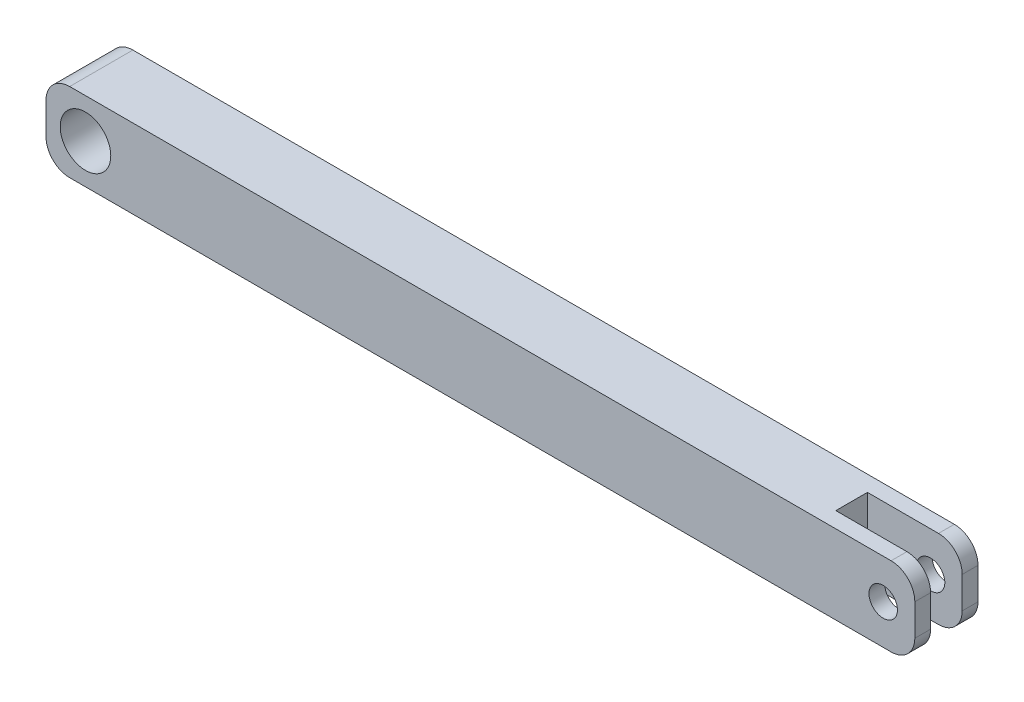
from build123d import *

# Parameters (mm, degrees)
SKETCH_5_W          = 55
SKETCH_5_H          = 3
EXTRUDE_1_DEPTH     = 5
CUT_EXTRUDE_1_REACH = 57.308
SKETCH_6_R          = 1.6
CUT_EXTRUDE_2_REACH = 57.308
SKETCH_7_R          = 0.9
FILLET_1_R          = 1.5
SKETCH_8_W          = 6
SKETCH_8_H          = 1.6
CUT_EXTRUDE_3_DEPTH = 10
SKETCH_10_R         = 1.6
SKETCH_10_R_2       = 0.9
EXTRUDE_2_DEPTH     = 0.5
EXTRUDE_START       = 0.5
SKETCH_11_R         = 0.9
SKETCH_11_R_2       = 1.6
EXTRUDE_3_DEPTH     = 0.5
SKETCH_12_W         = 6.141615249
SKETCH_12_H         = 2
CUT_EXTRUDE_4_DEPTH = 10


with BuildPart() as part:
    # 草图5 → 凸台-拉伸1 (new body)
    with BuildSketch(Plane(origin=(0, 0, 0), x_dir=(1, 0, 0), z_dir=(0, 1, 0))):
        with Locations((27.5, -1.5)):
            Rectangle(SKETCH_5_W, SKETCH_5_H)
    extrude(amount=EXTRUDE_1_DEPTH)

    # 草图6 → 切除-拉伸1 (cut, up to next)
    with BuildSketch(Plane.XY.offset(3), mode=Mode.PRIVATE) as cut_extrude_1_sk1:
        with Locations((2.5, 2.5)):
            Circle(SKETCH_6_R)
    cut_extrude_1_tool1 = extrude(cut_extrude_1_sk1.sketch, amount=-CUT_EXTRUDE_1_REACH, mode=Mode.PRIVATE) & part.part
    add(cut_extrude_1_tool1.solids().sort_by_distance((2.5, 2.5, 3))[0], mode=Mode.SUBTRACT)

    # 草图7 → 切除-拉伸2 (cut, up to next)
    with BuildSketch(Plane.XY, mode=Mode.PRIVATE) as cut_extrude_2_sk1:
        with Locations(Location((53, 2.5, 0), (0, 0, 180))):
            Circle(SKETCH_7_R)
    cut_extrude_2_tool1 = extrude(cut_extrude_2_sk1.sketch, amount=CUT_EXTRUDE_2_REACH, mode=Mode.PRIVATE) & part.part
    add(cut_extrude_2_tool1.solids().sort_by_distance((53, 2.5, 0))[0], mode=Mode.SUBTRACT)

    # 圆角1
    fillet_1_edges = [part.edges().sort_by_distance(p)[0] for p in [
        (55, 5, 1.5),
        (55, 0, 1.5),
        (0, 0, 1.5),
        (0, 5, 1.5),
    ]]
    fillet(fillet_1_edges, radius=FILLET_1_R)

    # 草图8 → 切除-拉伸3 (cut)
    with BuildSketch(Plane(origin=(0, 5, 0), x_dir=(1, 0, 0), z_dir=(0, 1, 0))):
        with Locations((52, -1.5)):
            Rectangle(SKETCH_8_W, SKETCH_8_H)
    extrude(amount=-CUT_EXTRUDE_3_DEPTH, mode=Mode.SUBTRACT)

    # 草图10 → 凸台-拉伸2 (add)
    with BuildSketch(Plane.XY.offset(3)):
        with BuildLine():
            Line((0, 3.5), (0, 1.5))
            ThreePointArc((0, 1.5), (0.439339828, 0.439339828), (1.5, 0))
            Line((1.5, 0), (53.5, 0))
            ThreePointArc((53.5, 0), (54.560660172, 0.439339828), (55, 1.5))
            Line((55, 1.5), (55, 3.5))
            ThreePointArc((55, 3.5), (54.560660172, 4.560660172), (53.5, 5))
            Line((53.5, 5), (1.5, 5))
            ThreePointArc((1.5, 5), (0.439339828, 4.560660172), (0, 3.5))
        make_face()
        with Locations((2.5, 2.5)):
            Circle(SKETCH_10_R, mode=Mode.SUBTRACT)
        with Locations((53, 2.5)):
            Circle(SKETCH_10_R_2, mode=Mode.SUBTRACT)
    extrude(amount=EXTRUDE_2_DEPTH)

    # 草图11 → 凸台-拉伸3 (add)
    with BuildSketch(Plane(origin=(0, 0, 0), x_dir=(-1, 0, 0), z_dir=(0, 0, -1)).offset(EXTRUDE_START)):
        with BuildLine():
            Line((-1.5, 5), (-53.5, 5))
            ThreePointArc((-53.5, 5), (-54.560660172, 4.560660172), (-55, 3.5))
            Line((-55, 3.5), (-55, 1.5))
            ThreePointArc((-55, 1.5), (-54.560660172, 0.439339828), (-53.5, 0))
            Line((-53.5, 0), (-1.5, 0))
            ThreePointArc((-1.5, 0), (-0.439339828, 0.439339828), (0, 1.5))
            Line((0, 1.5), (0, 3.5))
            ThreePointArc((0, 3.5), (-0.439339828, 4.560660172), (-1.5, 5))
        make_face()
        with Locations(Location((-53, 2.5, 0), (0, 0, 180))):
            Circle(SKETCH_11_R, mode=Mode.SUBTRACT)
        with Locations(Location((-2.5, 2.5, 0), (0, 0, 180))):
            Circle(SKETCH_11_R_2, mode=Mode.SUBTRACT)
    extrude(amount=-EXTRUDE_3_DEPTH)

    # 草图12 → 切除-拉伸4 (cut)
    with BuildSketch(Plane(origin=(0, 5, 0), x_dir=(1, 0, 0), z_dir=(0, 1, 0))):
        with Locations((52.070807625, -1.5)):
            Rectangle(SKETCH_12_W, SKETCH_12_H)
    extrude(amount=-CUT_EXTRUDE_4_DEPTH, mode=Mode.SUBTRACT)


solid = part.part
